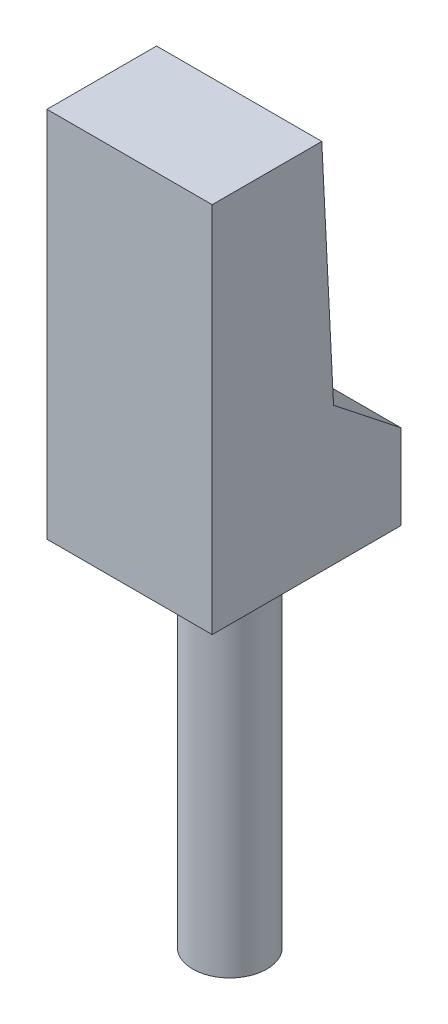
from build123d import *

# Parameters (mm, degrees)
SKETCH1_W           = 17.751360412
SKETCH1_H           = 20.289442188
BOSS_EXTRUDE1_DEPTH = 40
SKETCH2_R           = 3.980814887
CUT_EXTRUDE1_DEPTH  = 40


with BuildPart() as part:
    # Sketch1 → Boss-Extrude1 (new body)
    with BuildSketch(Plane(origin=(0, 0, 0), x_dir=(1, 0, 0), z_dir=(0, 1, 0))):
        with Locations((-8.875680206, 10.144721094)):
            Rectangle(SKETCH1_W, SKETCH1_H)
    extrude(amount=BOSS_EXTRUDE1_DEPTH)

    # Sweep1: sweep along a curve in space
    with BuildLine() as sweep1_path:
        Line((-8.636006498, 0, -10.530435866), (-8.636006498, -38.716526094, -10.530435866))
    # Sketch2 → Sweep1 (sweep)
    with BuildSketch(Plane(origin=(0, 0, 0), x_dir=(-1, 0, 0), z_dir=(0, -1, 0))):
        with Locations((8.636006498, 10.530435866)):
            Circle(SKETCH2_R)
    sweep(path=sweep1_path.line)

    # Sketch3 → Cut-Extrude1 (cut)
    with BuildSketch(Plane(origin=(0, 0, 0), x_dir=(0, 0, -1), z_dir=(1, 0, 0))):
        Polygon((27.331751958, 3.526611328), (13.036737594, 14.826732859), (11.549169686, 44.474117194), (29.802797672, 42.721399119), align=None)
    extrude(amount=-CUT_EXTRUDE1_DEPTH, mode=Mode.SUBTRACT)


solid = part.part
